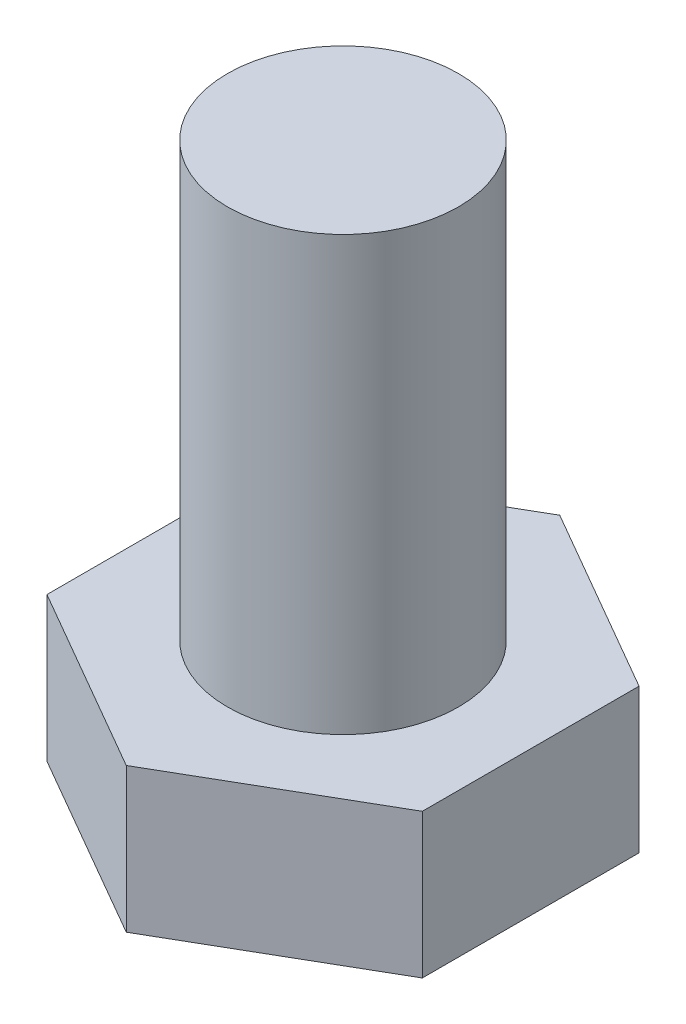
from build123d import *

# Parameters (mm, degrees)
BOSS_EXTRUDE1_DEPTH = 5
SKETCH2_R           = 4
BOSS_EXTRUDE2_DEPTH = 15


with BuildPart() as part:
    # Sketch1 → Boss-Extrude1 (new body)
    with BuildSketch(Plane(origin=(0, 0, 0), x_dir=(1, 0, 0), z_dir=(0, 1, 0))):
        Polygon((0, 7.505553499), (-6.5, 3.75277675), (-6.5, -3.75277675), (0, -7.505553499), (6.5, -3.75277675), (6.5, 3.75277675), align=None)
    extrude(amount=BOSS_EXTRUDE1_DEPTH)

    # Sketch2 → Boss-Extrude2 (add)
    with BuildSketch(Plane(origin=(0, 5, 0), x_dir=(1, 0, 0), z_dir=(0, 1, 0))):
        with Locations(Location((0, 0, 0), (0, 0, 270))):
            Circle(SKETCH2_R)
    extrude(amount=BOSS_EXTRUDE2_DEPTH)


solid = part.part
